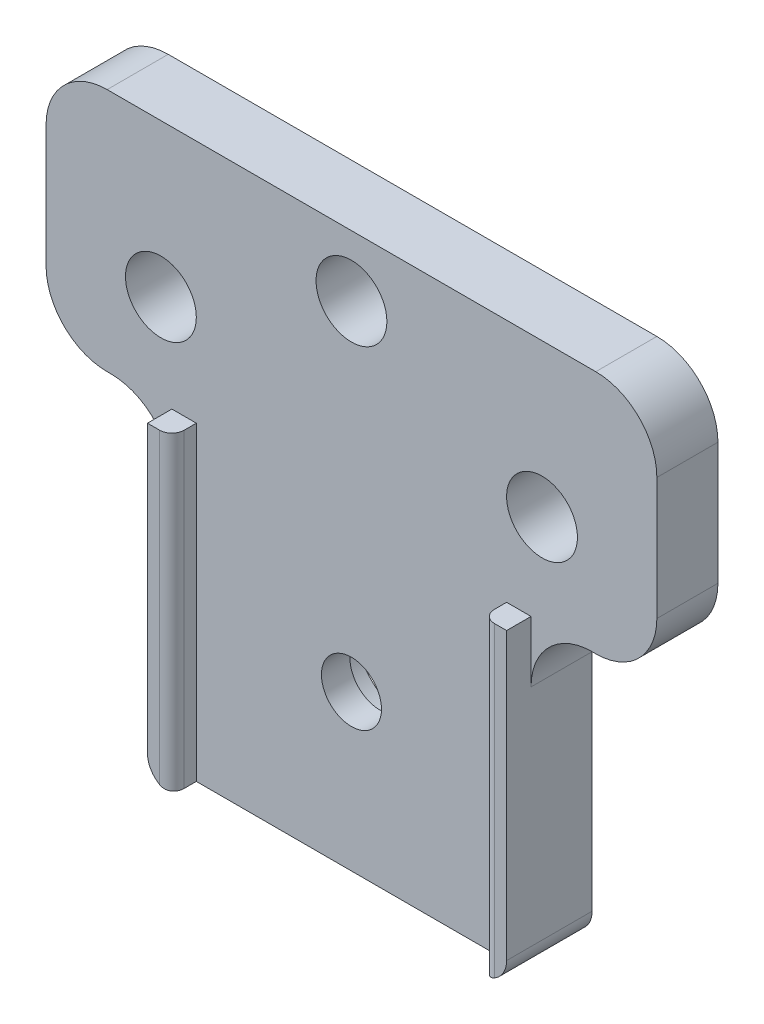
from build123d import *

# Parameters (mm, degrees)
SKETCH7_W                                           = 29.4
SKETCH7_H                                           = 40.4
BOSS_EXTRUDE3_DEPTH                                 = 5
BOSS_EXTRUDE4_DEPTH                                 = 25.4
SKETCH11_W                                          = 50
SKETCH11_H                                          = 15
BOSS_EXTRUDE5_DEPTH                                 = 5
CBORE_FOR_8_BINDING_HEAD_MACHINE_SCREW1_D           = 4.9149
CBORE_FOR_8_BINDING_HEAD_MACHINE_SCREW1_CBORE_D     = 9.525
CBORE_FOR_8_BINDING_HEAD_MACHINE_SCREW1_CBORE_DEPTH = 2.667
SKETCH18_W                                          = 50
SKETCH18_H                                          = 5
BOSS_EXTRUDE6_DEPTH                                 = 5
M5_CLEARANCE_HOLE1_D                                = 5.8
FILLET2_R                                           = 5
FILLET3_R                                           = 2


with BuildPart() as part:
    # Sketch7 → Boss-Extrude3 (new body)
    with BuildSketch(Plane.XY):
        Rectangle(SKETCH7_W, SKETCH7_H)
    extrude(amount=BOSS_EXTRUDE3_DEPTH)

    # Sketch8 → Boss-Extrude4 (add)
    with BuildSketch(Plane.XZ.offset(20.2)):
        with BuildLine():
            Line((-14.7, 5), (-12.7, 5))
            Line((-12.7, 5), (-12.7, 6))
            ThreePointArc((-12.7, 6), (-12.992893219, 6.707106781), (-13.7, 7))
            Line((-13.7, 7), (-14.7, 7))
            Line((-14.7, 7), (-14.7, 5))
        make_face()
        with BuildLine():
            Line((14.7, 5), (12.7, 5))
            Line((12.7, 5), (12.7, 6))
            ThreePointArc((12.7, 6), (12.992893219, 6.707106781), (13.7, 7))
            Line((13.7, 7), (14.7, 7))
            Line((14.7, 7), (14.7, 5))
        make_face()
    extrude(amount=-BOSS_EXTRUDE4_DEPTH)

    # Sketch11 → Boss-Extrude5 (add)
    with BuildSketch(Plane.XY.offset(5)):
        with Locations((0, 12.7)):
            Rectangle(SKETCH11_W, SKETCH11_H)
    extrude(amount=-BOSS_EXTRUDE5_DEPTH)

    # CBORE for #8 Binding Head Machine Screw1 (through all)
    with Locations(Plane(origin=(0, 0, 0), x_dir=(-1, 0, 0), z_dir=(0, 0, -1))):
        with Locations((0, -7.5)):
            CounterBoreHole(CBORE_FOR_8_BINDING_HEAD_MACHINE_SCREW1_D / 2, CBORE_FOR_8_BINDING_HEAD_MACHINE_SCREW1_CBORE_D / 2, CBORE_FOR_8_BINDING_HEAD_MACHINE_SCREW1_CBORE_DEPTH)

    # Sketch18 → Boss-Extrude6 (add)
    with BuildSketch(Plane(origin=(0, 20.2, 0), x_dir=(1, 0, 0), z_dir=(0, 1, 0))):
        with Locations((0, -2.5)):
            Rectangle(SKETCH18_W, SKETCH18_H)
    extrude(amount=BOSS_EXTRUDE6_DEPTH)

    # M5 Clearance Hole1 (through all)
    with Locations(Plane.XY.offset(5)):
        with Locations((-15.6, 12.7), (15.6, 12.7), (0, 20.2)):
            Hole(M5_CLEARANCE_HOLE1_D / 2)

    # Fillet2
    fillet2_edges = [part.edges().sort_by_distance(p)[0] for p in [
        (25, 5.2, 2.5),
        (-25, 5.2, 2.5),
        (-14.7, 5.2, 2.5),
        (14.7, 5.2, 2.5),
        (-25, 25.2, 2.5),
        (25, 25.2, 2.5),
    ]]
    fillet(fillet2_edges, radius=FILLET2_R)

    # Fillet3
    fillet3_edges = [part.edges().sort_by_distance(p)[0] for p in [
        (14.7, -20.2, 3.5),
        (-14.7, -20.2, 3.5),
    ]]
    fillet(fillet3_edges, radius=FILLET3_R)


solid = part.part
